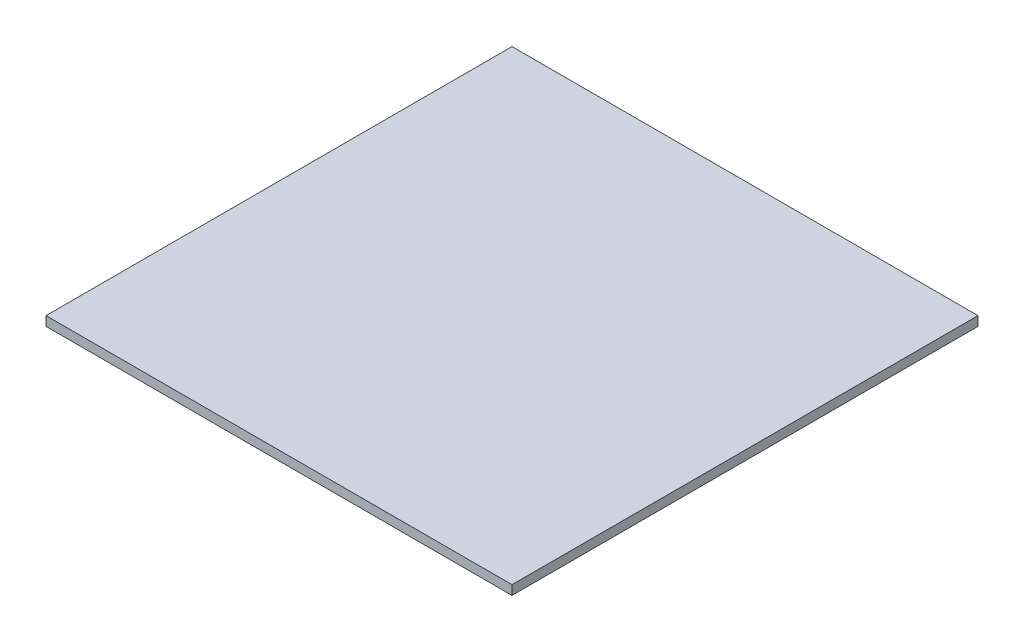
from build123d import *

# Parameters (mm, degrees)
SKETCH1_W           = 250
SKETCH1_H           = 250
BOSS_EXTRUDE1_DEPTH = 5


with BuildPart() as part:
    # Sketch1 → Boss-Extrude1 (new body)
    with BuildSketch(Plane(origin=(0, 0, 0), x_dir=(1, 0, 0), z_dir=(0, 1, 0))):
        Rectangle(SKETCH1_W, SKETCH1_H)
    extrude(amount=BOSS_EXTRUDE1_DEPTH)


solid = part.part
